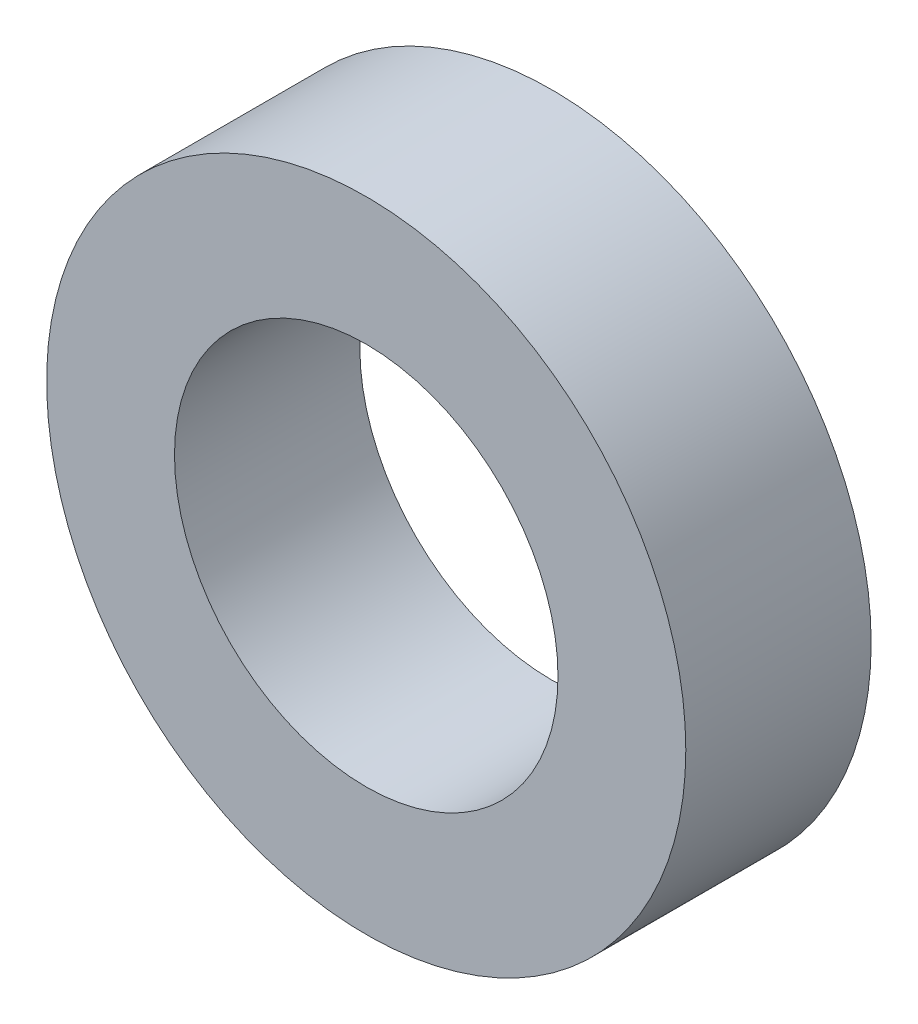
from build123d import *

# Parameters (mm, degrees)
SKETCH1_R           = 5
SKETCH1_R_2         = 3
BOSS_EXTRUDE1_DEPTH = 2.9


with BuildPart() as part:
    # Sketch1 → Boss-Extrude1 (new body)
    with BuildSketch(Plane.XY):
        Circle(SKETCH1_R)
        Circle(SKETCH1_R_2, mode=Mode.SUBTRACT)
    extrude(amount=BOSS_EXTRUDE1_DEPTH)


solid = part.part
